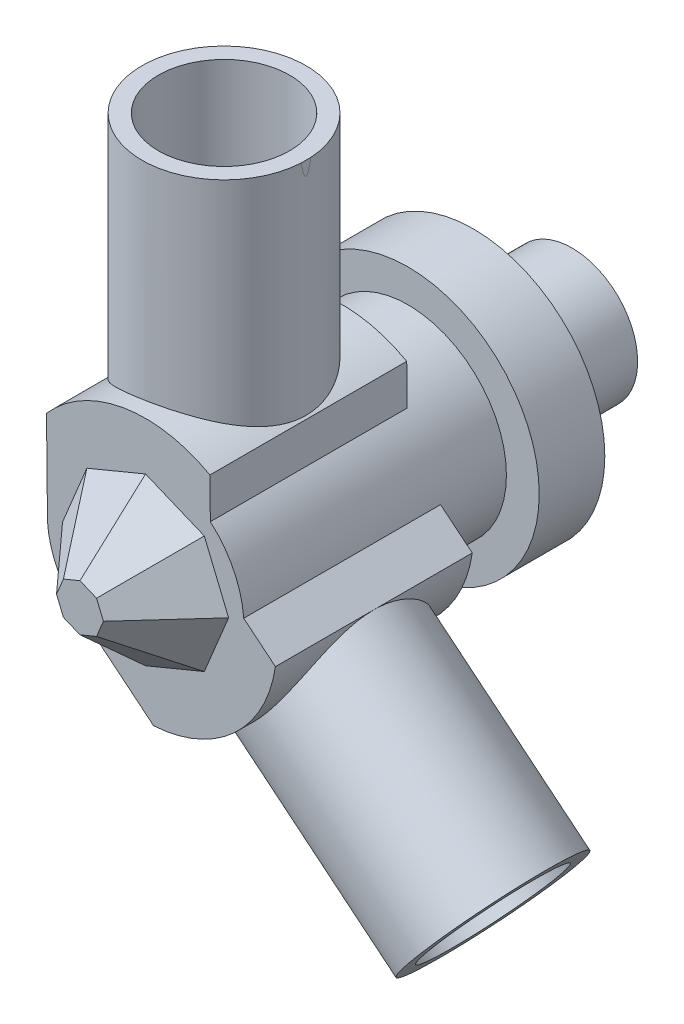
from build123d import *

# Parameters (mm, degrees)
SKETCH1_R               = 25.4
BOSS_EXTRUDE1_DEPTH     = 38.1
SKETCH2_R               = 50.8
BOSS_EXTRUDE2_DEPTH     = 25.4
SKETCH3_R               = 38.1
BOSS_EXTRUDE3_DEPTH     = 101.6
BOSS_EXTRUDE4_START     = -76.2
BOSS_EXTRUDE4_DEPTH     = 76.2
CUT_EXTRUDE1_REACH      = 316.552
CUT_EXTRUDE1_END_RADIUS = 50.8
SKETCH5_W               = 68.464599232
SKETCH5_H               = 81.28
SKETCH5_R               = 31.75
CUT_EXTRUDE2_REACH      = 310.247
CUT_EXTRUDE2_END_RADIUS = 50.8
SKETCH6_W               = 81.28
SKETCH6_H               = 68.58
SKETCH6_R               = 31.75
SKETCH7_R               = 25.4
CUT_EXTRUDE3_DEPTH      = 76.2
SKETCH8_R               = 25.4
CUT_EXTRUDE4_DEPTH      = 76.2
BOSS_EXTRUDE5_DEPTH     = 25.4
BOSS_EXTRUDE5_TAPER     = 40


with BuildPart() as part:
    # Sketch1 → Boss-Extrude1 (new body)
    with BuildSketch(Plane.XY):
        with Locations(Location((0, 0, 0), (0, 0, 180))):
            Circle(SKETCH1_R)
    extrude(amount=BOSS_EXTRUDE1_DEPTH)

    # Sketch2 → Boss-Extrude2 (add)
    with BuildSketch(Plane.XY.offset(38.1)):
        Circle(SKETCH2_R)
    extrude(amount=BOSS_EXTRUDE2_DEPTH)

    # Sketch3 → Boss-Extrude3 (add)
    with BuildSketch(Plane.XY.offset(63.5)):
        Circle(SKETCH3_R)
    extrude(amount=BOSS_EXTRUDE3_DEPTH)

    # Sketch4 → Boss-Extrude4 (add)
    with BuildSketch(Plane.XY.offset(165.1).offset(BOSS_EXTRUDE4_START)):
        with BuildLine():
            Line((37.998495941, 2.779263607), (116.531903161, -61.680521923))
            Line((116.531903161, -61.680521923), (76.244537205, -110.763901435))
            Line((76.244537205, -110.763901435), (-17.420498723, -33.884158898))
            ThreePointArc((-17.420498723, -33.884158898), (21.021777513, -31.775696219), (37.998495941, 2.779263607))
        make_face()
        with BuildLine():
            Line((25.073469731, 28.686775972), (23.972164439, 130.286775972))
            Line((23.972164439, 130.286775972), (-39.412434793, 130.286775972))
            Line((-39.412434793, 130.286775972), (-38.025917527, 2.374783413))
            ThreePointArc((-38.025917527, 2.374783413), (-14.663618724, 35.165157271), (25.073469731, 28.686775972))
        make_face()
    extrude(amount=BOSS_EXTRUDE4_DEPTH)

    # Cut-Extrude1: up to this cylinder (the profile starts outside it)
    cut_extrude1_end = Plane(origin=(0, 0, 166.577275), z_dir=(0, 0, -1)) * Cylinder(CUT_EXTRUDE1_END_RADIUS, 735.704, mode=Mode.PRIVATE)
    # Sketch5 → Cut-Extrude1 (cut, up to the surface)
    with BuildSketch(Plane(origin=(0, 130.286775972, 0), x_dir=(1, 0, 0), z_dir=(0, 1, 0)), mode=Mode.PRIVATE) as cut_extrude1_sk1:
        with Locations((-7.720135177, -127)):
            Rectangle(SKETCH5_W, SKETCH5_H)
        with Locations((-7.720135177, -127)):
            Circle(SKETCH5_R, mode=Mode.SUBTRACT)
    cut_extrude1_tool1 = extrude(cut_extrude1_sk1.sketch, amount=-CUT_EXTRUDE1_REACH, mode=Mode.PRIVATE) - cut_extrude1_end
    add(cut_extrude1_tool1.solids().sort_by_distance((-7.720135, 130.286776, 166.577275))[0], mode=Mode.SUBTRACT)

    # Cut-Extrude2: up to this cylinder (the profile starts outside it)
    cut_extrude2_end = Plane(origin=(0, 0, 166.576531), z_dir=(0, 0, -1)) * Cylinder(CUT_EXTRUDE2_END_RADIUS, 723.094, mode=Mode.PRIVATE)
    # Sketch6 → Cut-Extrude2 (cut, up to the surface)
    with BuildSketch(Plane(origin=(99.87368094, -81.975763963, 0), x_dir=(0, 0, -1), z_dir=(0.7729666064892688, -0.6344467079688128, 0)), mode=Mode.PRIVATE) as cut_extrude2_sk1:
        with Locations((-127, -5.493701383)):
            Rectangle(SKETCH6_W, SKETCH6_H)
        with Locations(Location((-127, -5.493701383, 0), (0, 0, 90))):
            Circle(SKETCH6_R, mode=Mode.SUBTRACT)
    cut_extrude2_tool1 = extrude(cut_extrude2_sk1.sketch, amount=-CUT_EXTRUDE2_REACH, mode=Mode.PRIVATE) - cut_extrude2_end
    add(cut_extrude2_tool1.solids().sort_by_distance((96.38822, -86.222212, 166.576531))[0], mode=Mode.SUBTRACT)

    # Sketch7 → Cut-Extrude3 (cut)
    with BuildSketch(Plane(origin=(99.87368094, -81.975763963, 0), x_dir=(0, 0, -1), z_dir=(0.7729666064892688, -0.6344467079688128, 0))):
        with Locations(Location((-127, -5.493701383, 0), (0, 0, 90))):
            Circle(SKETCH7_R)
    extrude(amount=-CUT_EXTRUDE3_DEPTH, mode=Mode.SUBTRACT)

    # Sketch8 → Cut-Extrude4 (cut)
    with BuildSketch(Plane(origin=(0, 130.286775972, 0), x_dir=(1, 0, 0), z_dir=(0, 1, 0))):
        with Locations(Location((-7.720135177, -127, 0), (0, 0, 270))):
            Circle(SKETCH8_R)
    extrude(amount=-CUT_EXTRUDE4_DEPTH, mode=Mode.SUBTRACT)

    # Sketch10 → Boss-Extrude5 (add)
    with BuildSketch(Plane.XY.offset(165.1)):
        Polygon((32.144869663, 0), (22.729855319, 22.729855319), (0, 32.144869663), (-22.729855319, 22.729855319), (-32.144869663, 0), (-22.729855319, -22.729855319), (0, -32.144869663), (22.729855319, -22.729855319), align=None)
    extrude(amount=BOSS_EXTRUDE5_DEPTH, taper=BOSS_EXTRUDE5_TAPER)


solid = part.part
